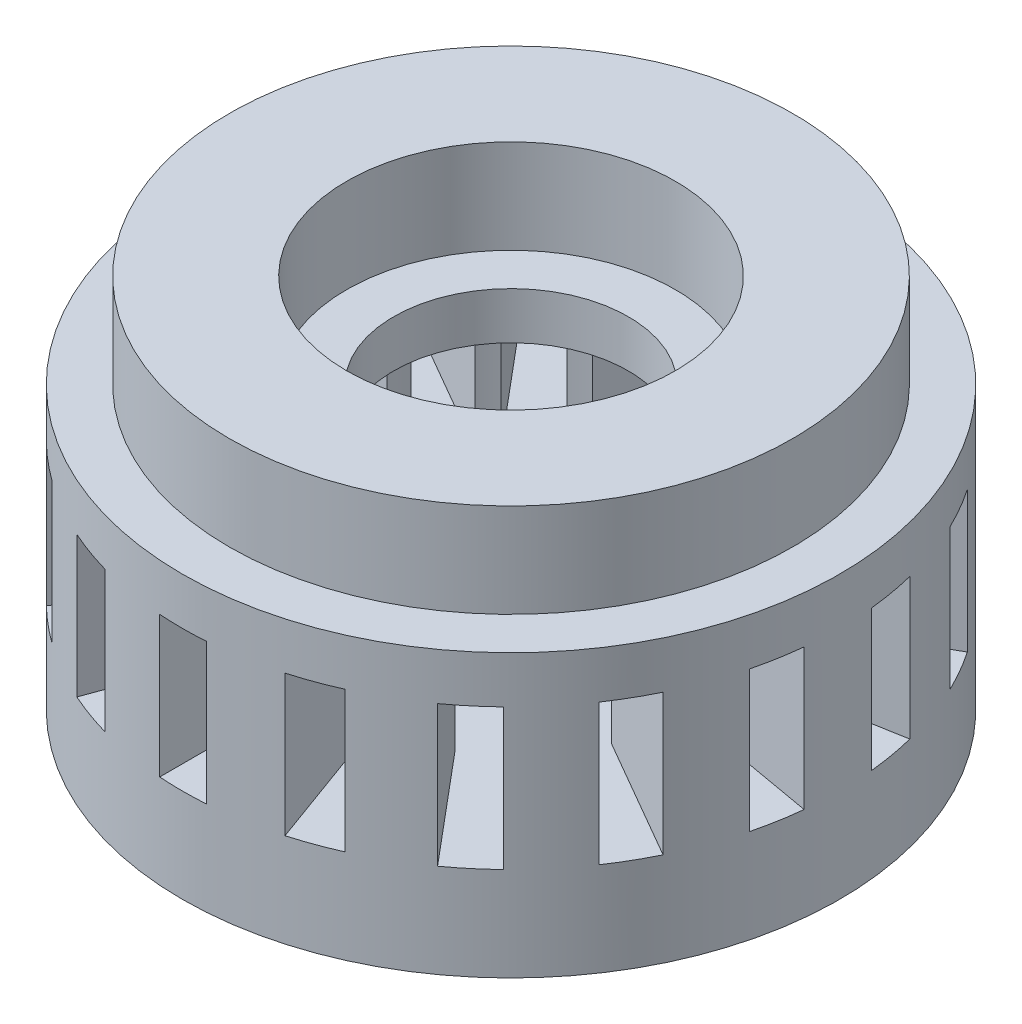
from build123d import *
from build123d.topology import SkipClean

# Parameters (mm, degrees)
SKETCH_1_R               = 3
EXTRUDE_1_DEPTH          = 1.5
SKETCH_2_R               = 7
EXTRUDE_2_DEPTH          = 2
SKETCH_3_R               = 7
EXTRUDE_3_DEPTH          = 3
SKETCH_4_W               = 1
SKETCH_4_H               = 3
CUT_EXTRUDE_1_DEPTH      = 12.842719282
PATTERN_CIRCULAR_1_COUNT = 9
SKETCH_8_R               = 4
CUT_EXTRUDE_3_DEPTH      = 3
SKETCH_5_R               = 7
EXTRUDE_4_DEPTH          = 1
SKETCH_6_R               = 6
EXTRUDE_5_DEPTH          = 2
SKETCH_7_R               = 3.5
CUT_EXTRUDE_2_DEPTH      = 2
SKETCH_9_R               = 2.5
CUT_EXTRUDE_4_DEPTH      = 1


with BuildPart() as part:
    # 草图1 → 凸台-拉伸1 (new body)
    with BuildSketch(Plane(origin=(0, 0, 0), x_dir=(1, 0, 0), z_dir=(0, 1, 0))):
        with Locations(Location((0, 0, 0), (0, 0, 270))):
            Circle(SKETCH_1_R)
        with BuildLine():
            Line((-1.299038106, 0.75), (1.299038106, 0.75))
            ThreePointArc((1.299038106, 0.75), (0, -1.5), (-1.299038106, 0.75))
        make_face(mode=Mode.SUBTRACT)
    extrude(amount=EXTRUDE_1_DEPTH)

    # 草图2 → 凸台-拉伸2 (add)
    with SkipClean():  # the faces are left unmerged after this step: merging them gives an invalid solid
        with BuildSketch(Plane(origin=(0, 1.5, 0), x_dir=(1, 0, 0), z_dir=(0, 1, 0))):
            with Locations(Location((0, 0, 0), (0, 0, 270))):
                Circle(SKETCH_2_R)
            with BuildLine():
                Line((1.299038106, 0.75), (-1.299038106, 0.75))
                ThreePointArc((-1.299038106, 0.75), (0, -1.5), (1.299038106, 0.75))
            make_face(mode=Mode.SUBTRACT)
        extrude(amount=EXTRUDE_2_DEPTH)

    # 草图3 → 凸台-拉伸3 (add)
    with SkipClean():  # the faces are left unmerged after this step: merging them gives an invalid solid
        with BuildSketch(Plane(origin=(0, 3.5, 0), x_dir=(1, 0, 0), z_dir=(0, 1, 0))):
            with Locations(Location((0, 0, 0), (0, 0, 270))):
                Circle(SKETCH_3_R)
        extrude(amount=EXTRUDE_3_DEPTH)

    # 草图4 → 切除-拉伸1 (cut, symmetric)
    with SkipClean():  # the faces are left unmerged after this step: merging them gives an invalid solid
        with BuildSketch(Plane.XY):
            with Locations((0, 5)):
                Rectangle(SKETCH_4_W, SKETCH_4_H)
        cut_extrude_1 = extrude(amount=CUT_EXTRUDE_1_DEPTH, both=True, mode=Mode.SUBTRACT)

    # 阵列(圆周)1: 切除-拉伸1 ×9 about axis
    with SkipClean():  # the faces are left unmerged after this step: merging them gives an invalid solid
        pattern_circular_1_axis = Axis((0, 0, 0), (0, 1, 0))
        for i in range(1, PATTERN_CIRCULAR_1_COUNT):
            add(cut_extrude_1.rotate(pattern_circular_1_axis, i * 360 / PATTERN_CIRCULAR_1_COUNT), mode=Mode.SUBTRACT)

    # 草图8 → 切除-拉伸3 (cut)
    with SkipClean():  # the faces are left unmerged after this step: merging them gives an invalid solid
        with BuildSketch(Plane(origin=(0, 6.5, 0), x_dir=(1, 0, 0), z_dir=(0, 1, 0))):
            Circle(SKETCH_8_R)
        extrude(amount=-CUT_EXTRUDE_3_DEPTH, mode=Mode.SUBTRACT)

    # 草图5 → 凸台-拉伸4 (add)
    with BuildSketch(Plane(origin=(0, 6.5, 0), x_dir=(1, 0, 0), z_dir=(0, 1, 0))):
        with Locations(Location((0, 0, 0), (0, 0, 270))):
            Circle(SKETCH_5_R)
    extrude(amount=EXTRUDE_4_DEPTH)

    # 草图6 → 凸台-拉伸5 (add)
    with BuildSketch(Plane(origin=(0, 7.5, 0), x_dir=(1, 0, 0), z_dir=(0, 1, 0))):
        with Locations(Location((0, 0, 0), (0, 0, 270))):
            Circle(SKETCH_6_R)
    extrude(amount=EXTRUDE_5_DEPTH)

    # 草图7 → 切除-拉伸2 (cut)
    with BuildSketch(Plane(origin=(0, 9.5, 0), x_dir=(1, 0, 0), z_dir=(0, 1, 0))):
        with Locations(Location((0, 0, 0), (0, 0, 270))):
            Circle(SKETCH_7_R)
    extrude(amount=-CUT_EXTRUDE_2_DEPTH, mode=Mode.SUBTRACT)

    # 草图9 → 切除-拉伸4 (cut)
    with BuildSketch(Plane(origin=(0, 7.5, 0), x_dir=(1, 0, 0), z_dir=(0, 1, 0))):
        with Locations(Location((0, 0, 0), (0, 0, 270))):
            Circle(SKETCH_9_R)
    extrude(amount=-CUT_EXTRUDE_4_DEPTH, mode=Mode.SUBTRACT)


solid = part.part
